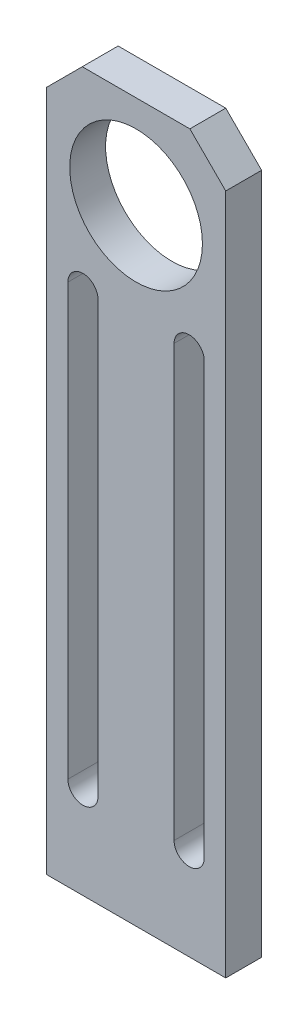
from build123d import *

# Parameters (mm, degrees)
SKETCH1_R           = 9.25
BOSS_EXTRUDE1_DEPTH = 2.5


with BuildPart() as part:
    # Sketch1 → Boss-Extrude1 (new, symmetric)
    with BuildSketch(Plane.XY):
        Polygon((-7.5, 50), (7.5, 50), (12.5, 45), (12.5, -50), (-12.5, -50), (-12.5, 45), align=None)
        with Locations((0, 37)):
            Circle(SKETCH1_R, mode=Mode.SUBTRACT)
        with BuildLine():
            Line((9.5, 23), (9.5, -37))
            ThreePointArc((9.5, -37), (7.4, -39.1), (5.3, -37))
            Line((5.3, -37), (5.3, 23))
            ThreePointArc((5.3, 23), (7.4, 25.1), (9.5, 23))
        make_face(mode=Mode.SUBTRACT)
        with BuildLine():
            Line((-9.5, 23), (-9.5, -37))
            ThreePointArc((-9.5, -37), (-7.4, -39.1), (-5.3, -37))
            Line((-5.3, -37), (-5.3, 23))
            ThreePointArc((-5.3, 23), (-7.4, 25.1), (-9.5, 23))
        make_face(mode=Mode.SUBTRACT)
    extrude(amount=BOSS_EXTRUDE1_DEPTH, both=True)


solid = part.part
